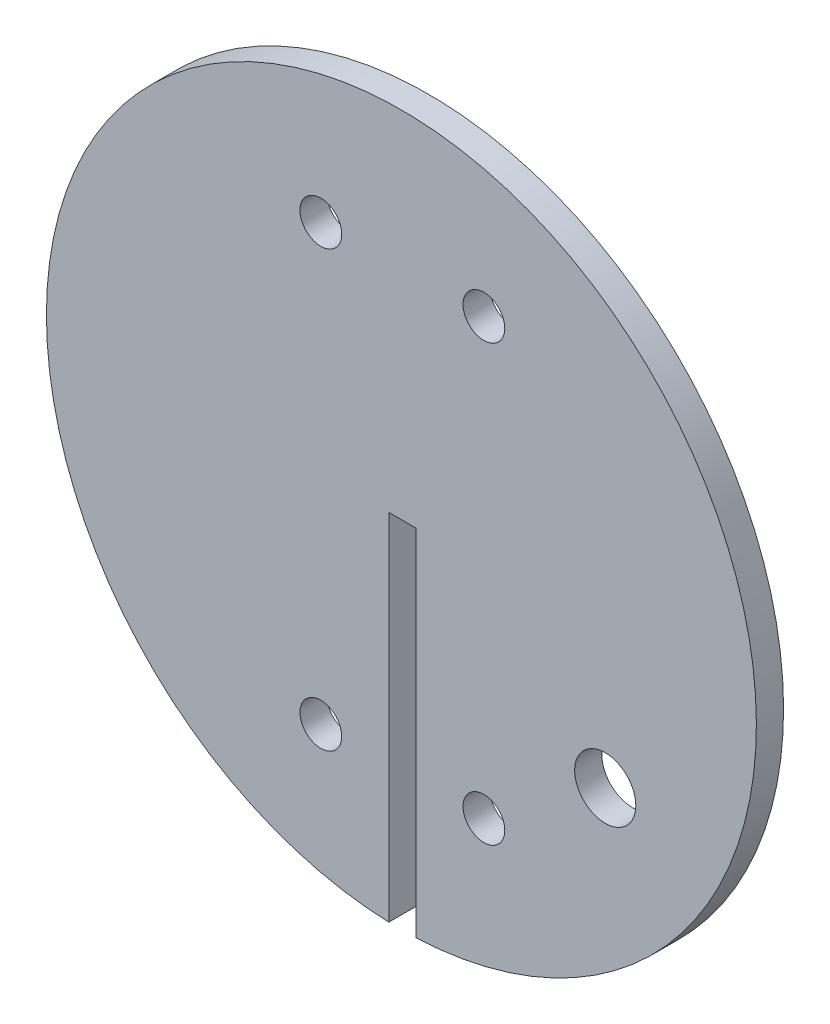
from build123d import *

# Parameters (mm, degrees)
SKETCH1_R           = 66.3575
BOSS_EXTRUDE1_DEPTH = 5.08
CUT_EXTRUDE2_REACH  = 95.981
SKETCH3_R           = 3.900616975
SKETCH3_R_2         = 5.715
SKETCH3_W           = 5.08
SKETCH3_H           = 67.8815


with BuildPart() as part:
    # Sketch1 → Boss-Extrude1 (new body)
    with BuildSketch(Plane.XY):
        Circle(SKETCH1_R)
    extrude(amount=BOSS_EXTRUDE1_DEPTH)

    # Sketch3 → Cut-Extrude2 (cut, up to next)
    with BuildSketch(Plane.XY, mode=Mode.PRIVATE) as cut_extrude2_sk1:
        with Locations((-15.06192248, -40.64)):
            Circle(SKETCH3_R)
    cut_extrude2_tool1 = extrude(cut_extrude2_sk1.sketch, amount=CUT_EXTRUDE2_REACH, mode=Mode.PRIVATE) & part.part
    # Sketch3 → Cut-Extrude2 (cut, up to next)
    with BuildSketch(Plane.XY, mode=Mode.PRIVATE) as cut_extrude2_sk2:
        with Locations((15.41807752, -40.64)):
            Circle(SKETCH3_R)
    cut_extrude2_tool2 = extrude(cut_extrude2_sk2.sketch, amount=CUT_EXTRUDE2_REACH, mode=Mode.PRIVATE) & part.part
    # Sketch3 → Cut-Extrude2 (cut, up to next)
    with BuildSketch(Plane.XY, mode=Mode.PRIVATE) as cut_extrude2_sk3:
        with Locations(Location((15.41807752, 40.64, 0), (0, 0, 180))):
            Circle(SKETCH3_R)
    cut_extrude2_tool3 = extrude(cut_extrude2_sk3.sketch, amount=CUT_EXTRUDE2_REACH, mode=Mode.PRIVATE) & part.part
    # Sketch3 → Cut-Extrude2 (cut, up to next)
    with BuildSketch(Plane.XY, mode=Mode.PRIVATE) as cut_extrude2_sk4:
        with Locations(Location((-15.06192248, 40.64, 0), (0, 0, 180))):
            Circle(SKETCH3_R)
    cut_extrude2_tool4 = extrude(cut_extrude2_sk4.sketch, amount=CUT_EXTRUDE2_REACH, mode=Mode.PRIVATE) & part.part
    # Sketch3 → Cut-Extrude2 (cut, up to next)
    with BuildSketch(Plane.XY, mode=Mode.PRIVATE) as cut_extrude2_sk5:
        with Locations((38.1, -24.368533315)):
            Circle(SKETCH3_R_2)
    cut_extrude2_tool5 = extrude(cut_extrude2_sk5.sketch, amount=CUT_EXTRUDE2_REACH, mode=Mode.PRIVATE) & part.part
    # Sketch3 → Cut-Extrude2 (cut, up to next)
    with BuildSketch(Plane.XY, mode=Mode.PRIVATE) as cut_extrude2_sk6:
        with Locations((0.17807752, -33.91789821)):
            Rectangle(SKETCH3_W, SKETCH3_H)
    cut_extrude2_tool6 = extrude(cut_extrude2_sk6.sketch, amount=CUT_EXTRUDE2_REACH, mode=Mode.PRIVATE) & part.part
    add(cut_extrude2_tool1.solids().sort_by_distance((-15.061922, -40.64, 0))[0], mode=Mode.SUBTRACT)
    add(cut_extrude2_tool2.solids().sort_by_distance((15.418078, -40.64, 0))[0], mode=Mode.SUBTRACT)
    add(cut_extrude2_tool3.solids().sort_by_distance((15.418078, 40.64, 0))[0], mode=Mode.SUBTRACT)
    add(cut_extrude2_tool4.solids().sort_by_distance((-15.061922, 40.64, 0))[0], mode=Mode.SUBTRACT)
    add(cut_extrude2_tool5.solids().sort_by_distance((38.1, -24.368533, 0))[0], mode=Mode.SUBTRACT)
    add(cut_extrude2_tool6.solids().sort_by_distance((0.178078, -33.917898, 0))[0], mode=Mode.SUBTRACT)


solid = part.part
